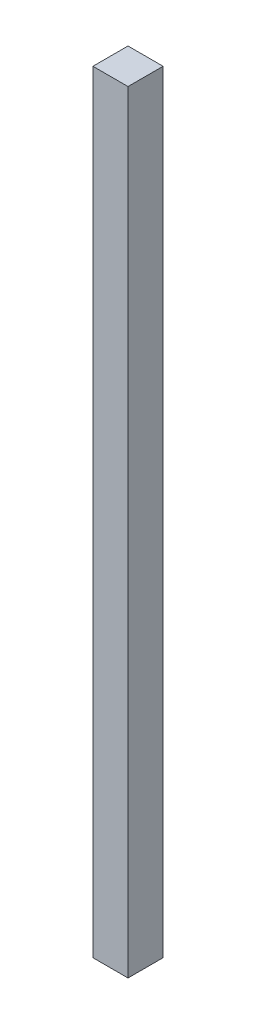
from build123d import *

# Parameters (mm, degrees)
SKETCH1_W           = 20
SKETCH1_H           = 20
BOSS_EXTRUDE1_DEPTH = 440


with BuildPart() as part:
    # Sketch1 → Boss-Extrude1 (new body)
    with BuildSketch(Plane(origin=(0, 0, 0), x_dir=(1, 0, 0), z_dir=(0, 1, 0))):
        Rectangle(SKETCH1_W, SKETCH1_H)
    extrude(amount=BOSS_EXTRUDE1_DEPTH)


solid = part.part
